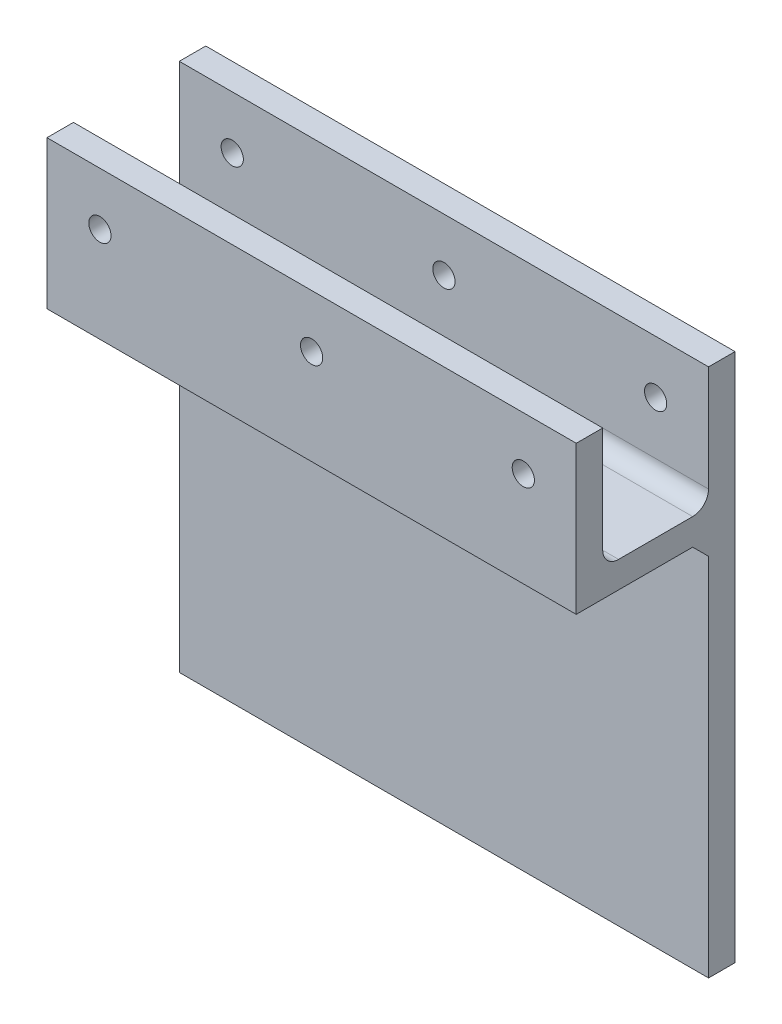
from build123d import *

# Parameters (mm, degrees)
SKETCH_1_W          = 100
SKETCH_1_H          = 72
EXTRUDE_1_DEPTH     = 5
SKETCH_1_H_2        = 23
EXTRUDE_1_2_DEPTH   = 5
SKETCH_1_3_W        = 100
SKETCH_1_3_H        = 5
EXTRUDE_2_DEPTH     = 30
SKETCH_2_W          = 100
SKETCH_2_H          = 5
EXTRUDE_3_DEPTH     = 23
SKETCH_3_R          = 2.1
CUT_EXTRUDE_1_DEPTH = 77.811457479
FILLET_1_R          = 3
EXTRUDE_4_DEPTH     = 100


with BuildPart() as part:
    # 草图1 → 凸台-拉伸1 (new body)
    with BuildSketch(Plane.XY):
        with Locations((0, -14)):
            Rectangle(SKETCH_1_W, SKETCH_1_H)
    extrude(amount=EXTRUDE_1_DEPTH)



with BuildPart() as body_2:
    # 草图1 → Extrude 1 2 (new body)
    with BuildSketch(Plane.XY):
        with Locations((0, 38.5)):
            Rectangle(SKETCH_1_W, SKETCH_1_H_2)
    extrude(amount=EXTRUDE_1_2_DEPTH)


with BuildPart() as part_1:
    add(part.part)

    add(body_2.part)  # 凸台-拉伸2 merges body 2
    # 草图1<3> → 凸台-拉伸2 (add)
    with BuildSketch(Plane.XY):
        with Locations((0, 24.5)):
            Rectangle(SKETCH_1_3_W, SKETCH_1_3_H)
    extrude(amount=EXTRUDE_2_DEPTH)

    # 草图2 → 凸台-拉伸3 (add)
    with BuildSketch(Plane(origin=(0, 27, 0), x_dir=(1, 0, 0), z_dir=(0, 1, 0))):
        with Locations((0, -27.5)):
            Rectangle(SKETCH_2_W, SKETCH_2_H)
    extrude(amount=EXTRUDE_3_DEPTH)

    # 草图3 → 切除-拉伸1 (cut, through all)
    with BuildSketch(Plane.XY.offset(30)):
        with Locations((-40, 40)):
            Circle(SKETCH_3_R)
        with Locations((0, 40)):
            Circle(SKETCH_3_R)
        with Locations((40, 40)):
            Circle(SKETCH_3_R)
    extrude(amount=-CUT_EXTRUDE_1_DEPTH, mode=Mode.SUBTRACT)

    # 圆角1
    fillet_1_edges = [part_1.edges().sort_by_distance(p)[0] for p in [
        (0, 27, 5),
        (0, 27, 25),
    ]]
    fillet(fillet_1_edges, radius=FILLET_1_R)

    # 草图8 → 凸台-拉伸4 (add, through all)
    with BuildSketch(Plane.ZY.offset(50)):
        Polygon((5, 19), (8, 22), (5, 22), align=None)
    extrude(amount=-EXTRUDE_4_DEPTH)


solid = part_1.part
